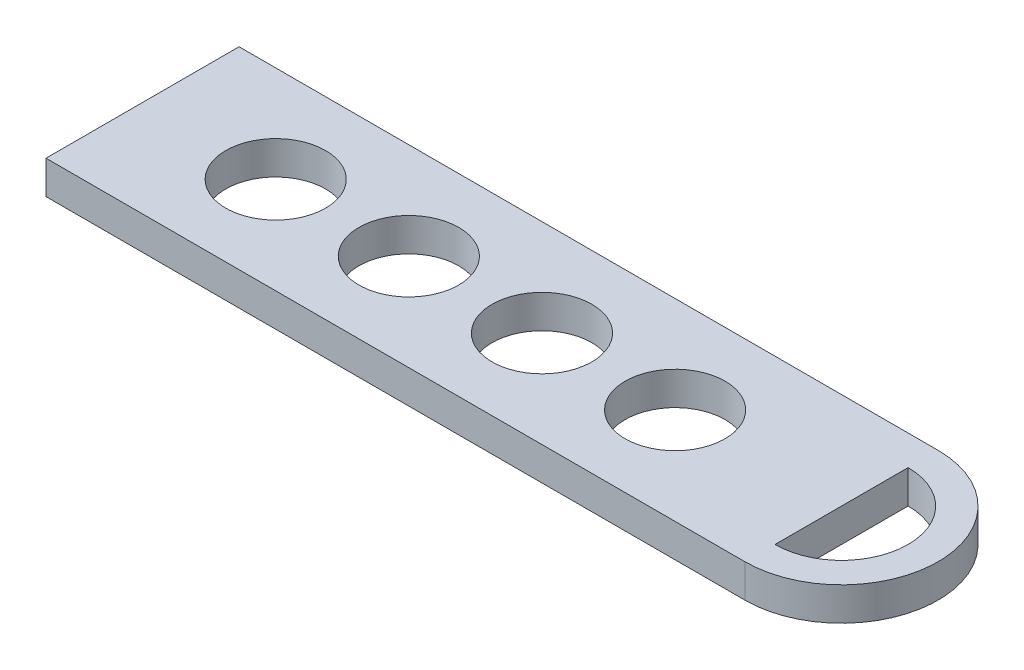
from build123d import *

# Parameters (mm, degrees)
SKETCH1_W           = 29
SKETCH1_H           = 5
BOSS_EXTRUDE1_DEPTH = 105
SKETCH2_R           = 7.5
CUT_EXTRUDE1_DEPTH  = 105
BOSS_EXTRUDE2_DEPTH = 5


with BuildPart() as part:
    # Sketch1 → Boss-Extrude1 (new body)
    with BuildSketch(Plane(origin=(0, 0, 0), x_dir=(0, 0, -1), z_dir=(1, 0, 0))):
        Rectangle(SKETCH1_W, SKETCH1_H)
    extrude(amount=BOSS_EXTRUDE1_DEPTH)

    # Sketch2 → Cut-Extrude1 (cut)
    with BuildSketch(Plane.XZ.offset(2.5)):
        with Locations(Location((20, 0, 0), (0, 0, 270))):
            Circle(SKETCH2_R)
        with Locations(Location((40, 0, 0), (0, 0, 270))):
            Circle(SKETCH2_R)
        with Locations(Location((60, 0, 0), (0, 0, 270))):
            Circle(SKETCH2_R)
        with Locations(Location((80, 0, 0), (0, 0, 270))):
            Circle(SKETCH2_R)
    extrude(amount=-CUT_EXTRUDE1_DEPTH, mode=Mode.SUBTRACT)

    # Sketch3 → Boss-Extrude2 (add)
    with BuildSketch(Plane.XZ.offset(2.5)):
        with BuildLine():
            Line((105, 14.5), (105, 10))
            ThreePointArc((105, 10), (115, 0), (105, -10))
            Line((105, -10), (105, -14.5))
            ThreePointArc((105, -14.5), (119.5, 0), (105, 14.5))
        make_face()
    extrude(amount=-BOSS_EXTRUDE2_DEPTH)


solid = part.part
